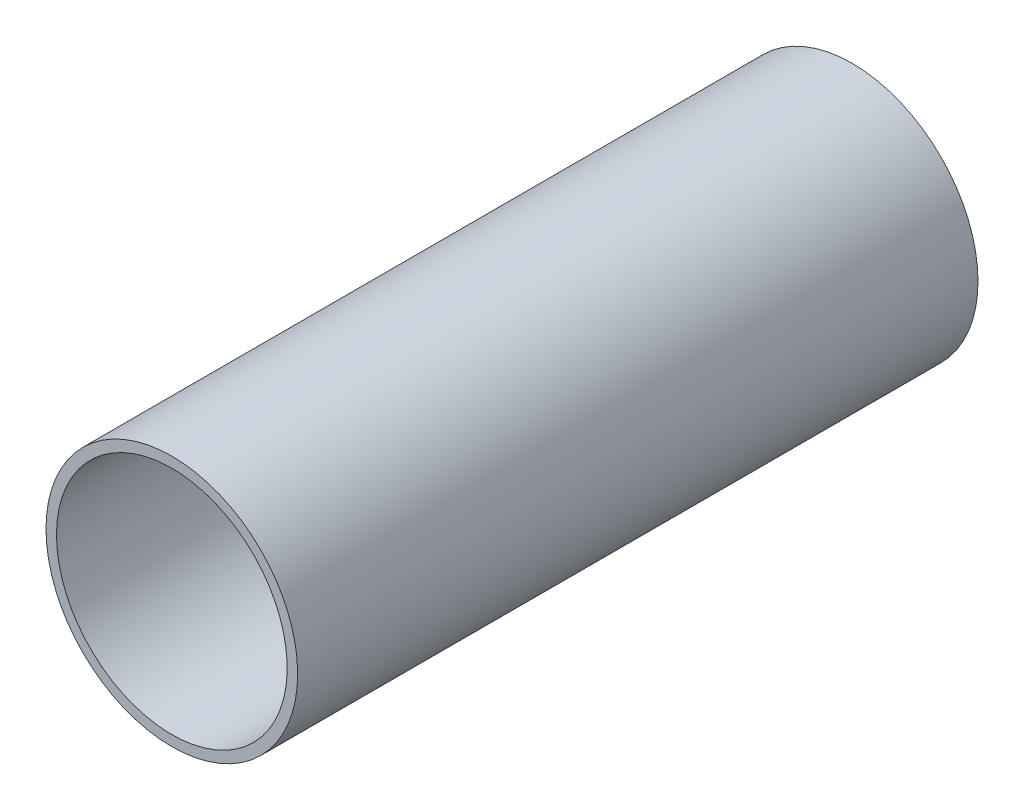
from build123d import *

# Parameters (mm, degrees)
SKETCH1_R           = 76.2
SKETCH1_R_2         = 69.85
BOSS_EXTRUDE1_DEPTH = 206


with BuildPart() as part:
    # Sketch1 → Boss-Extrude1 (new, symmetric)
    with BuildSketch(Plane.XY):
        with Locations(Location((0, 0, 0), (0, 0, 180))):
            Circle(SKETCH1_R)
        with Locations(Location((0, 0, 0), (0, 0, 180))):
            Circle(SKETCH1_R_2, mode=Mode.SUBTRACT)
    extrude(amount=BOSS_EXTRUDE1_DEPTH, both=True)


solid = part.part
